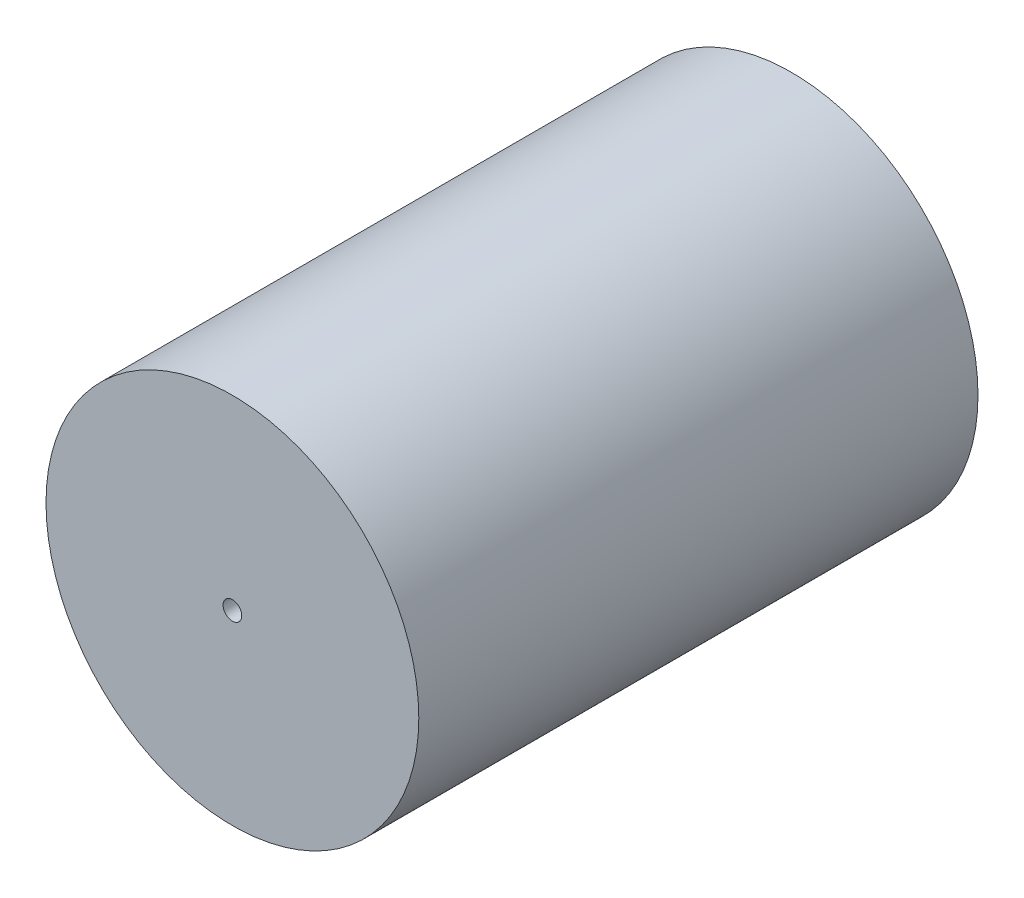
from build123d import *

# Parameters (mm, degrees)
SKETCH1_R           = 100
SKETCH1_R_2         = 5
BOSS_EXTRUDE1_DEPTH = 300


with BuildPart() as part:
    # Sketch1 → Boss-Extrude1 (new body)
    with BuildSketch(Plane.XY):
        Circle(SKETCH1_R)
        Circle(SKETCH1_R_2, mode=Mode.SUBTRACT)
    extrude(amount=BOSS_EXTRUDE1_DEPTH)


solid = part.part
